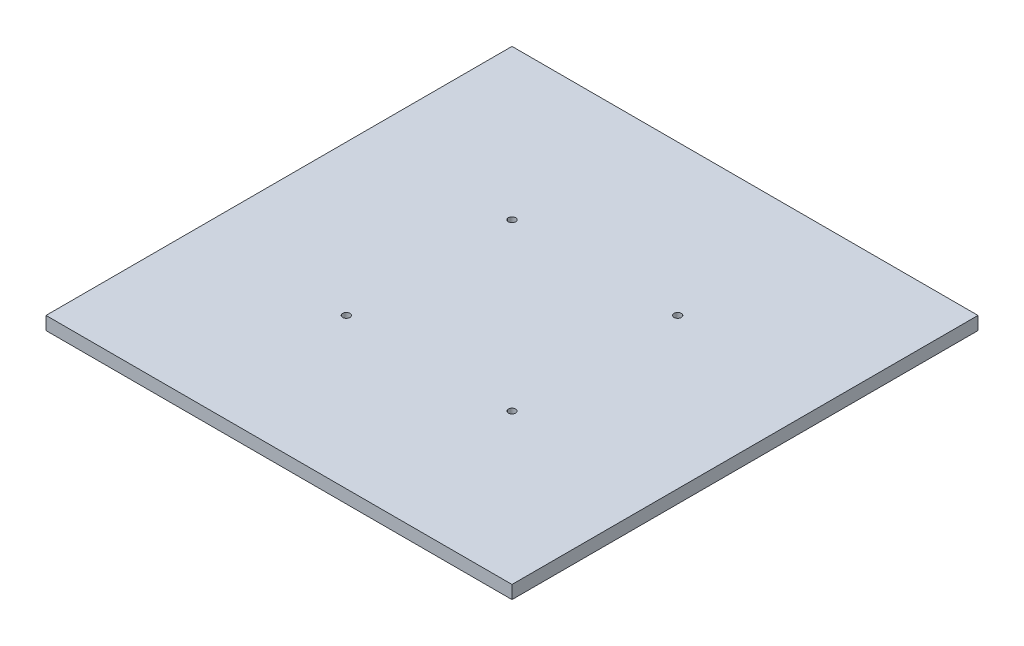
from build123d import *

# Parameters (mm, degrees)
ESBO_O1_W                 = 450
ESBO_O1_H                 = 450
RESSALTO_EXTRUS_O1_DEPTH  = 12.7
FURO_ROSCADO_DE_M8X1_01_D = 7


with BuildPart() as part:
    # Esboço1 → Ressalto-extrusão1 (new body)
    with BuildSketch(Plane(origin=(0, 0, 0), x_dir=(1, 0, 0), z_dir=(0, 1, 0))):
        Rectangle(ESBO_O1_W, ESBO_O1_H)
    extrude(amount=RESSALTO_EXTRUS_O1_DEPTH)

    # Furo roscado de M8x1.01 (through all)
    with Locations(Plane(origin=(0, 12.7, 0), x_dir=(1, 0, 0), z_dir=(0, 1, 0))):
        with Locations((-80, 80), (80, 80), (80, -80), (-80, -80)):
            Hole(FURO_ROSCADO_DE_M8X1_01_D / 2)


solid = part.part
